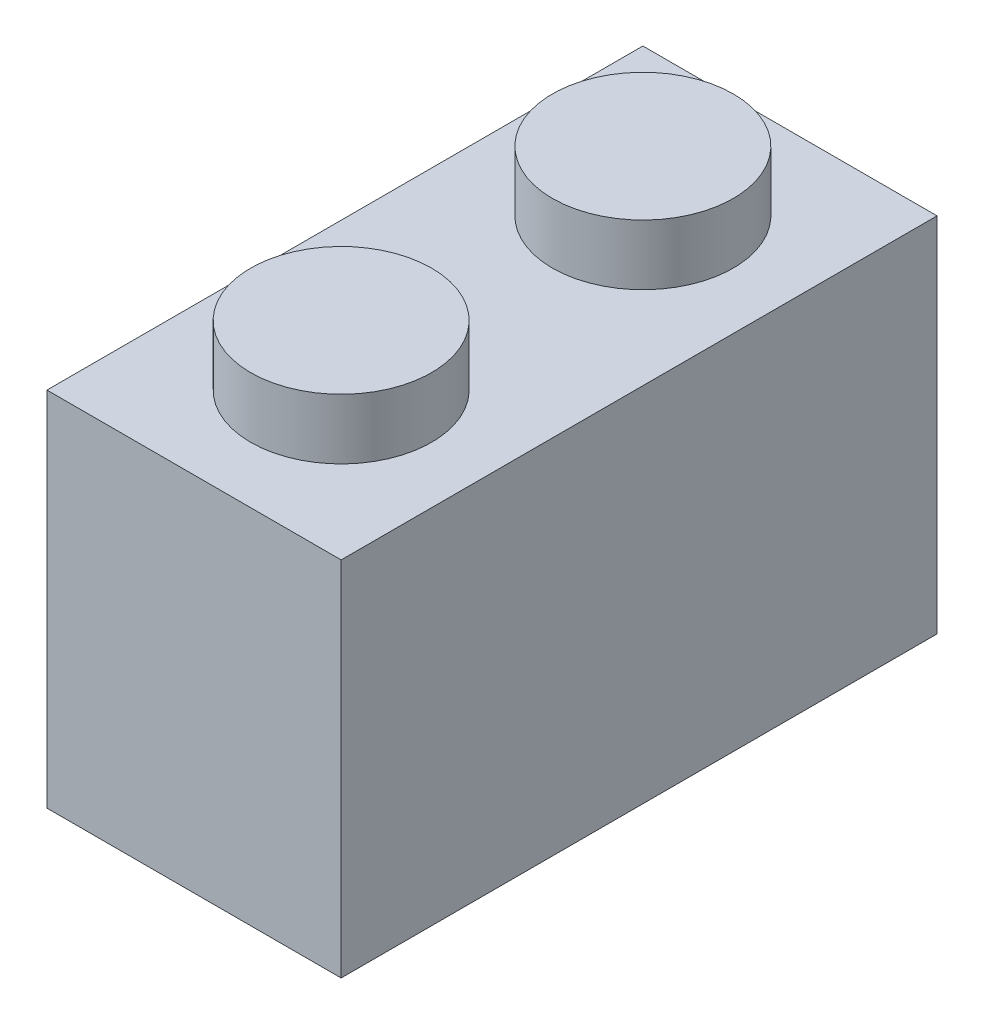
from build123d import *

# Parameters (mm, degrees)
SKETCH1_W            = 7.8
SKETCH1_H            = 9.6
BOSS_EXTRUDE1_DEPTH  = 15.8
SKETCH2_R            = 2.4
BOSS_EXTRUDE2_DEPTH  = 1.6
LPATTERN1_COUNT      = 2
LPATTERN1_PITCH      = 8
LPATTERN1_COUNT_DIR2 = 4
LPATTERN1_PITCH_DIR2 = 8
SHELL1_T             = -1.2
SKETCH5_R            = 1.5
BOSS_EXTRUDE4_DEPTH  = 8.2


with BuildPart() as part:
    # Sketch1 → Boss-Extrude1 (new body)
    with BuildSketch(Plane.XY):
        with Locations((3.9, 4.8)):
            Rectangle(SKETCH1_W, SKETCH1_H)
    extrude(amount=-BOSS_EXTRUDE1_DEPTH)

    # Sketch2 → Boss-Extrude2 (add)
    with BuildSketch(Plane(origin=(0, 9.6, 0), x_dir=(1, 0, 0), z_dir=(0, 1, 0))):
        with Locations(Location((3.9, 3.9, 0), (0, 0, 270))):
            Circle(SKETCH2_R)
    boss_extrude2 = extrude(amount=BOSS_EXTRUDE2_DEPTH)

    # LPattern1: Boss-Extrude2 2 × 4, 6 skipped
    with Locations(*[(-j * LPATTERN1_PITCH_DIR2, 0, -i * LPATTERN1_PITCH) for i in range(LPATTERN1_COUNT) for j in range(LPATTERN1_COUNT_DIR2) if (i, j) not in ((0, 0), (0, 1), (0, 2), (0, 3), (1, 1), (1, 2), (1, 3))]):
        add(boss_extrude2)

    # Shell1
    shell1_openings = [part.faces().sort_by_distance(p)[0] for p in [
        (3.9, 0, -7.9),
    ]]
    offset(amount=SHELL1_T, openings=shell1_openings, kind=Kind.INTERSECTION)

    # Sketch5 → Boss-Extrude4 (add)
    with BuildSketch(Plane.XZ.offset(-8.4)):
        with Locations(Location((3.9, -7.9, 0), (0, 0, 90))):
            Circle(SKETCH5_R)
    extrude(amount=BOSS_EXTRUDE4_DEPTH)


solid = part.part
